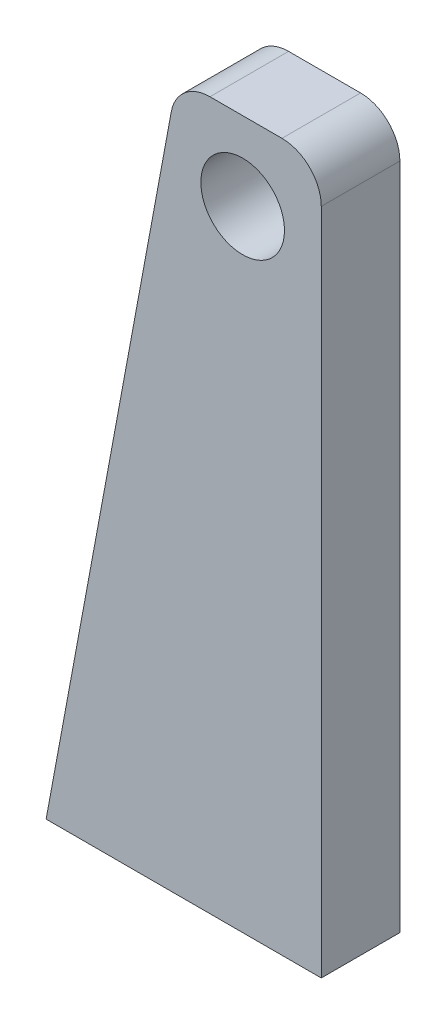
from build123d import *

# Parameters (mm, degrees)
SKETCH1_R           = 3.3782
BOSS_EXTRUDE1_DEPTH = 6.35


with BuildPart() as part:
    # Sketch1 → Boss-Extrude1 (new body)
    with BuildSketch(Plane.XY):
        with BuildLine():
            Line((0, 0), (0, 53.975))
            ThreePointArc((0, 53.975), (-0.92993597, 56.22006403), (-3.175, 57.15))
            Line((-3.175, 57.15), (-8.990537957, 57.15))
            ThreePointArc((-8.990537957, 57.15), (-11.020719671, 56.416103686), (-12.112354692, 54.55369273))
            Line((-12.112354692, 54.55369273), (-22.225, 0))
            Line((-22.225, 0), (0, 0))
        make_face()
        with Locations((-6.35, 50.8)):
            Circle(SKETCH1_R, mode=Mode.SUBTRACT)
    extrude(amount=BOSS_EXTRUDE1_DEPTH)


solid = part.part
